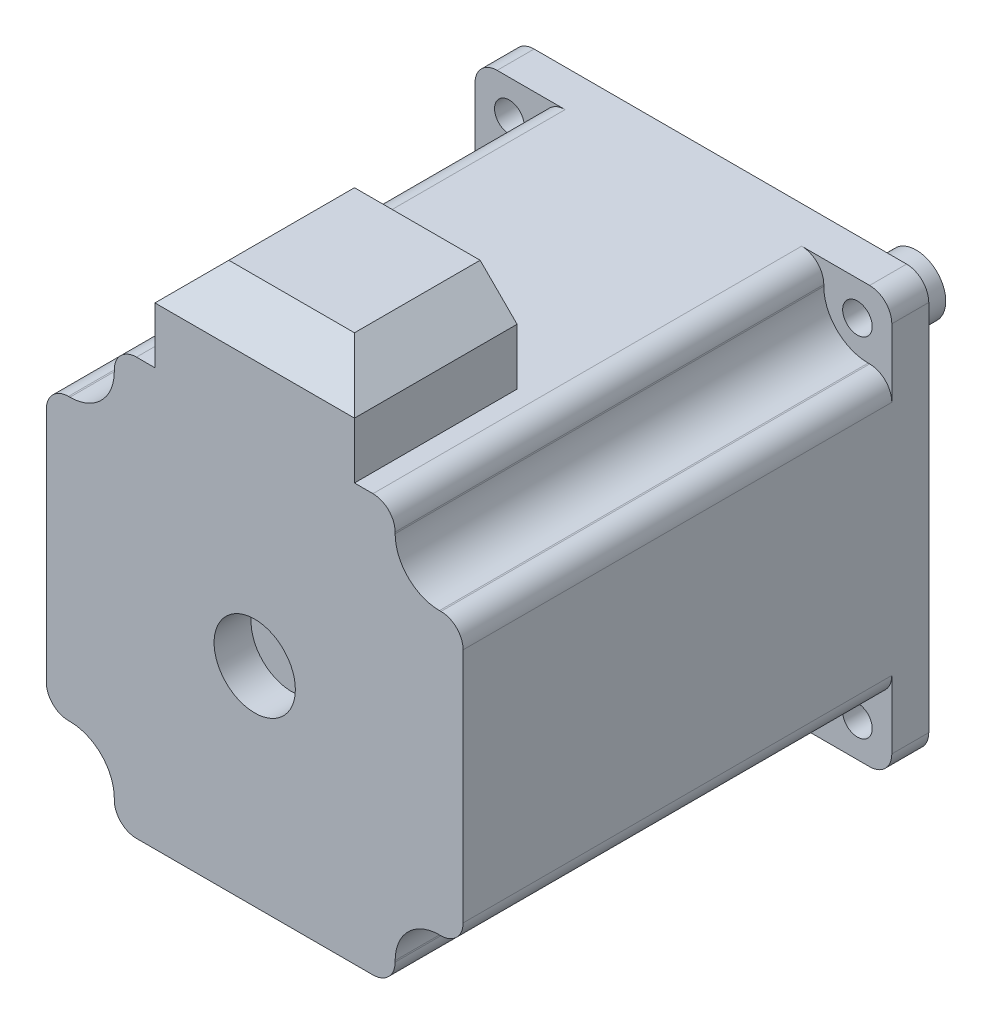
from build123d import *

# Parameters (mm, degrees)
SKETCH_1_W          = 56.4
SKETCH_1_H          = 56.4
EXTRUDE_1_DEPTH     = 63
SKETCH_2_R          = 2
CUT_EXTRUDE_1_DEPTH = 63
SKETCH_3_W          = 9.2
SKETCH_3_H          = 9.2
CUT_EXTRUDE_2_DEPTH = 58
FILLET_1_R          = 3
FILLET_2_R          = 6
SKETCH_7_R          = 19
CUT_EXTRUDE_4_DEPTH = 20
EXTRUDE_START       = 1.5
SKETCH_4_R          = 19
EXTRUDE_2_DEPTH     = 1.5
SKETCH_5_R          = 4
EXTRUDE_3_DEPTH     = 25
SKETCH_8_R          = 5.5
CUT_EXTRUDE_5_DEPTH = 5
SKETCH_11_W         = 27
SKETCH_11_H         = 12.6
EXTRUDE_4_DEPTH     = 22
CHAMFER_3_SIZE      = 5


with BuildPart() as part:
    # 草图1 → 凸台-拉伸1 (new body)
    with BuildSketch(Plane.XY):
        Rectangle(SKETCH_1_W, SKETCH_1_H)
    extrude(amount=EXTRUDE_1_DEPTH)

    # 草图2 → 切除-拉伸1 (cut)
    with BuildSketch(Plane(origin=(0, 0, 0), x_dir=(-1, 0, 0), z_dir=(0, 0, -1))):
        with Locations((23.55, 23.55)):
            Circle(SKETCH_2_R)
        with Locations((23.55, -23.55)):
            Circle(SKETCH_2_R)
        with Locations(Location((-23.55, -23.55, 0), (0, 0, 180))):
            Circle(SKETCH_2_R)
        with Locations(Location((-23.55, 23.55, 0), (0, 0, 180))):
            Circle(SKETCH_2_R)
    extrude(amount=-CUT_EXTRUDE_1_DEPTH, mode=Mode.SUBTRACT)

    # 草图3 → 切除-拉伸2 (cut)
    with BuildSketch(Plane.XY.offset(63)):
        with Locations((-23.6, -23.6)):
            Rectangle(SKETCH_3_W, SKETCH_3_H)
        with Locations((23.6, -23.6)):
            Rectangle(SKETCH_3_W, SKETCH_3_H)
        with Locations((-23.6, 23.6)):
            Rectangle(SKETCH_3_W, SKETCH_3_H)
        with Locations((23.6, 23.6)):
            Rectangle(SKETCH_3_W, SKETCH_3_H)
    extrude(amount=-CUT_EXTRUDE_2_DEPTH, mode=Mode.SUBTRACT)

    # 圆角1
    fillet_1_edges = [part.edges().sort_by_distance(p)[0] for p in [
        (28.2, -28.2, 2.5),
        (-28.2, -28.2, 2.5),
        (-28.2, 28.2, 2.5),
        (28.2, 28.2, 2.5),
        (19, -28.2, 34),
        (28.2, -19, 34),
        (-19, 28.2, 34),
        (-28.2, 19, 34),
        (-19, -28.2, 34),
        (-28.2, -19, 34),
        (19, 28.2, 34),
        (28.2, 19, 34),
    ]]
    fillet(fillet_1_edges, radius=FILLET_1_R)

    # 圆角2
    fillet_2_edges = [part.edges().sort_by_distance(p)[0] for p in [
        (19, -19, 34),
        (-19, 19, 34),
        (-19, -19, 34),
        (19, 19, 34),
    ]]
    fillet(fillet_2_edges, radius=FILLET_2_R)

    # 草图7 → 切除-拉伸4 (cut)
    with BuildSketch(Plane(origin=(0, 0, 0), x_dir=(-1, 0, 0), z_dir=(0, 0, -1))):
        Circle(SKETCH_7_R)
    extrude(amount=-CUT_EXTRUDE_4_DEPTH, mode=Mode.SUBTRACT)

    # 草图8 → 切除-拉伸5 (cut)
    with BuildSketch(Plane.XY.offset(63)):
        Circle(SKETCH_8_R)
    extrude(amount=-CUT_EXTRUDE_5_DEPTH, mode=Mode.SUBTRACT)

    # 草图11 → 凸台-拉伸4 (add)
    with BuildSketch(Plane.XY.offset(63)):
        with Locations((0, 34.5)):
            Rectangle(SKETCH_11_W, SKETCH_11_H)
    extrude(amount=-EXTRUDE_4_DEPTH)

    # 倒角3
    chamfer_3_edges = [part.edges().sort_by_distance(p)[0] for p in [
        (-13.5, 40.8, 52),
        (13.5, 40.8, 52),
        (0, 40.8, 63),
    ]]
    chamfer(chamfer_3_edges, length=CHAMFER_3_SIZE)


with BuildPart() as body_2:
    # 草图4 → 凸台-拉伸2 (new body)
    with BuildSketch(Plane(origin=(0, 0, 0), x_dir=(-1, 0, 0), z_dir=(0, 0, -1)).offset(EXTRUDE_START)):
        Circle(SKETCH_4_R)
    extrude(amount=-EXTRUDE_2_DEPTH)


with BuildPart() as body_3:
    # 草图5 → 凸台-拉伸3 (new body)
    with BuildSketch(Plane(origin=(0, 0, -1.5), x_dir=(-1, 0, 0), z_dir=(0, 0, -1))):
        Circle(SKETCH_5_R)
    extrude(amount=EXTRUDE_3_DEPTH)


solid = Compound([part.part, body_2.part, body_3.part])
